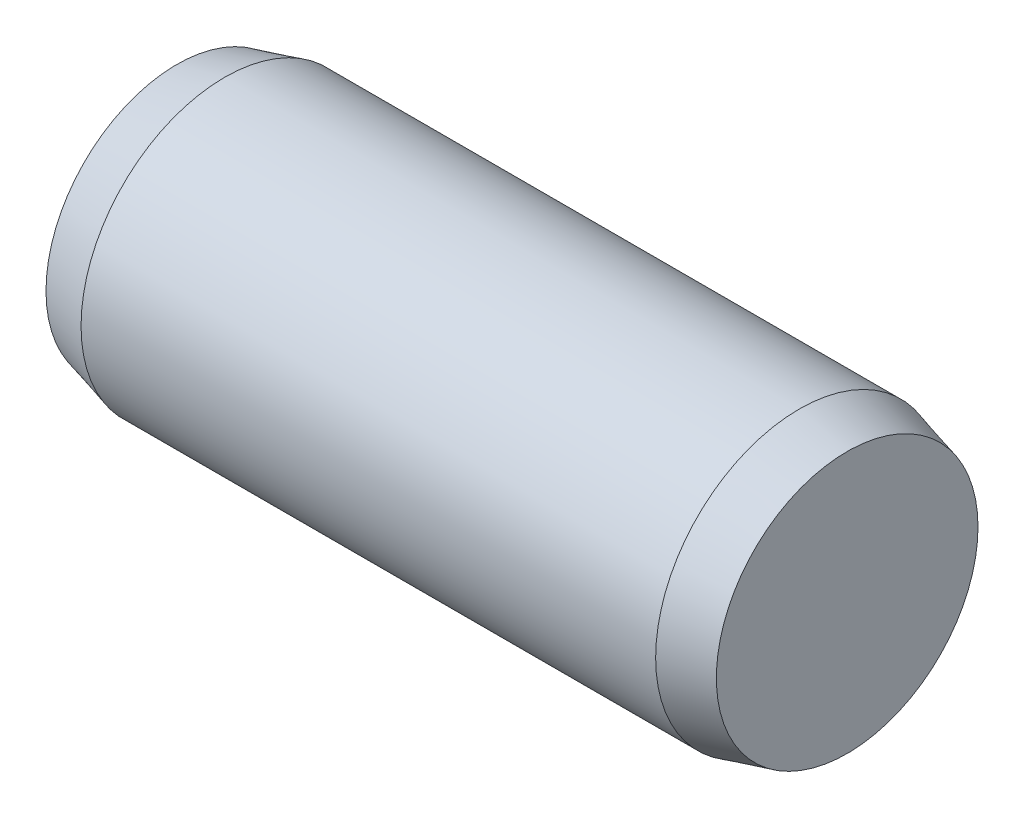
from build123d import *

# Parameters (mm, degrees)
EXTRUDE1_DEPTH      = 3
EXTRUDE1_DEPTH_BACK = 3
SKETCH2_R           = 1.5
SKETCH3_R           = 1.5
EXTRUDE2_DEPTH      = 0.5
EXTRUDE2_TAPER      = 15
SKETCH4_R           = 1.5
EXTRUDE3_DEPTH      = 0.5
EXTRUDE3_TAPER      = 15


with BuildPart() as part:
    # Sketch2 → Extrude1 (new, two sides: drawn at the far end of the back side and taken through both)
    with BuildSketch(Plane(origin=(0, 0, 0), x_dir=(0, 0, -1), z_dir=(1, 0, 0)).offset(-EXTRUDE1_DEPTH_BACK)):
        Circle(SKETCH2_R)
    extrude(amount=EXTRUDE1_DEPTH + EXTRUDE1_DEPTH_BACK)

    # Sketch3 → Extrude2 (add)
    with BuildSketch(Plane(origin=(3, 0, 0), x_dir=(0, 0, -1), z_dir=(1, 0, 0))):
        Circle(SKETCH3_R)
    extrude(amount=EXTRUDE2_DEPTH, taper=EXTRUDE2_TAPER)

    # Sketch4 → Extrude3 (add)
    with BuildSketch(Plane.ZY.offset(3)):
        with Locations(Location((0, 0, 0), (0, 0, 180))):
            Circle(SKETCH4_R)
    extrude(amount=EXTRUDE3_DEPTH, taper=EXTRUDE3_TAPER)


solid = part.part
